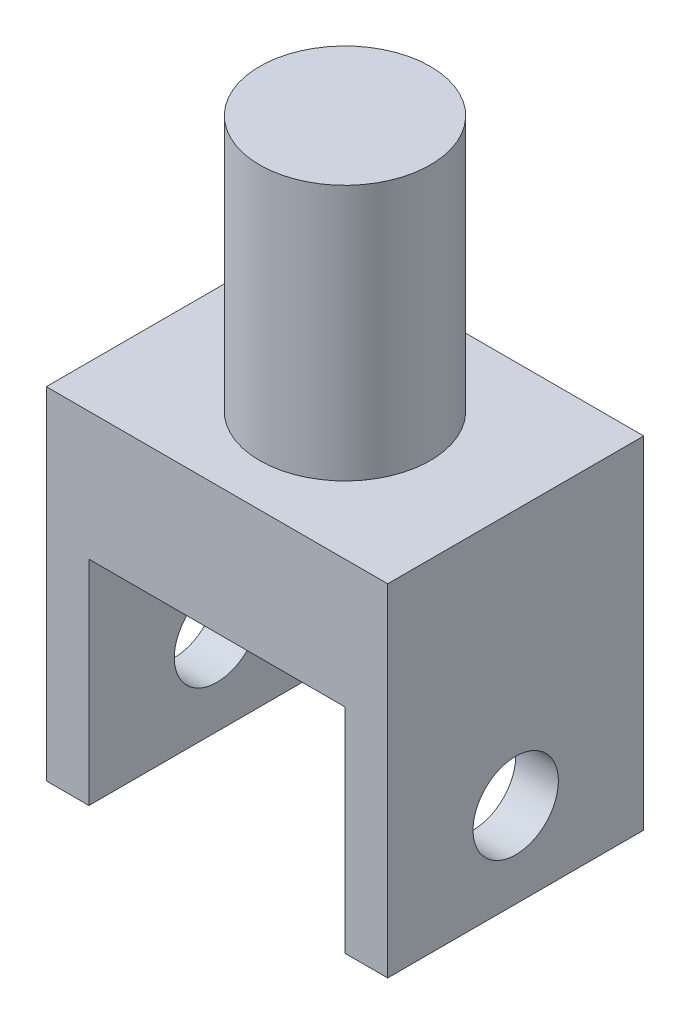
from build123d import *

# Parameters (mm, degrees)
SKETCH1_W           = 101.6
SKETCH1_H           = 76.2
BOSS_EXTRUDE1_DEPTH = 101.6
SKETCH2_W           = 76.2
SKETCH2_H           = 76.2
CUT_EXTRUDE1_DEPTH  = 63.5
SKETCH3_R           = 12.7
CUT_EXTRUDE2_DEPTH  = 149.649688866
SKETCH4_R           = 25.4
BOSS_EXTRUDE2_DEPTH = 76.2


with BuildPart() as part:
    # Sketch1 → Boss-Extrude1 (new body)
    with BuildSketch(Plane(origin=(0, 0, 0), x_dir=(1, 0, 0), z_dir=(0, 1, 0))):
        Rectangle(SKETCH1_W, SKETCH1_H)
    extrude(amount=BOSS_EXTRUDE1_DEPTH)

    # Sketch2 → Cut-Extrude1 (cut)
    with BuildSketch(Plane.XZ):
        Rectangle(SKETCH2_W, SKETCH2_H)
    extrude(amount=-CUT_EXTRUDE1_DEPTH, mode=Mode.SUBTRACT)

    # Sketch3 → Cut-Extrude2 (cut, through all)
    with BuildSketch(Plane(origin=(50.8, 0, 0), x_dir=(0, 0, -1), z_dir=(1, 0, 0))):
        with Locations((0, 25.4)):
            Circle(SKETCH3_R)
    extrude(amount=-CUT_EXTRUDE2_DEPTH, mode=Mode.SUBTRACT)

    # Sketch4 → Boss-Extrude2 (add)
    with BuildSketch(Plane(origin=(0, 101.6, 0), x_dir=(1, 0, 0), z_dir=(0, 1, 0))):
        with Locations(Location((0, 0, 0), (0, 0, 90))):
            Circle(SKETCH4_R)
    extrude(amount=BOSS_EXTRUDE2_DEPTH)


solid = part.part
